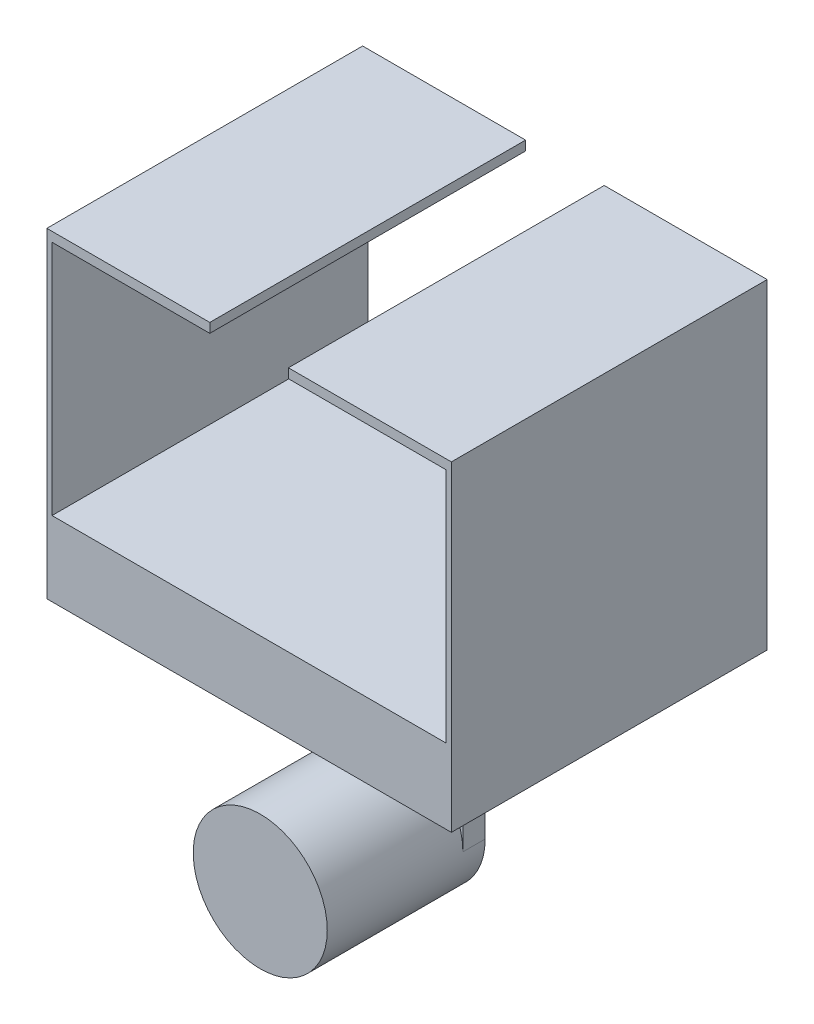
from build123d import *

# Parameters (mm, degrees)
SKETCH1_R           = 10.7823
BOSS_EXTRUDE1_DEPTH = 25.4
SKETCH2_W           = 21.5646
SKETCH2_H           = 25.4
BOSS_EXTRUDE2_DEPTH = 3.5814
SKETCH6_W           = 65.0748
SKETCH6_H           = 50.8
BOSS_EXTRUDE3_DEPTH = 51.6128
SKETCH7_W           = 63.40856
SKETCH7_H           = 38.0746
CUT_EXTRUDE1_DEPTH  = 98.827878248
SKETCH8_W           = 12.6492
SKETCH8_H           = 1.524
CUT_EXTRUDE2_DEPTH  = 98.827878248


with BuildPart() as part:
    # Sketch1 → Boss-Extrude1 (new body)
    with BuildSketch(Plane.XY):
        Circle(SKETCH1_R)
    extrude(amount=-BOSS_EXTRUDE1_DEPTH)

    # Sketch2 → Boss-Extrude2 (add)
    with BuildSketch(Plane(origin=(0, 0, -25.4), x_dir=(-1, 0, 0), z_dir=(0, 0, -1))):
        with Locations((0, 12.7)):
            Rectangle(SKETCH2_W, SKETCH2_H)
    extrude(amount=-BOSS_EXTRUDE2_DEPTH)

    # Sketch6 → Boss-Extrude3 (add)
    with BuildSketch(Plane(origin=(0, 25.4, 0), x_dir=(1, 0, 0), z_dir=(0, 1, 0))):
        with Locations((0, 23.6093)):
            Rectangle(SKETCH6_W, SKETCH6_H)
    extrude(amount=BOSS_EXTRUDE3_DEPTH)

    # Sketch7 → Cut-Extrude1 (cut, through all)
    with BuildSketch(Plane.XY.offset(1.7907)):
        with Locations((0, 56.4515)):
            Rectangle(SKETCH7_W, SKETCH7_H)
    extrude(amount=-CUT_EXTRUDE1_DEPTH, mode=Mode.SUBTRACT)

    # Sketch8 → Cut-Extrude2 (cut, through all)
    with BuildSketch(Plane.XY.offset(1.7907)):
        with Locations((0, 76.2508)):
            Rectangle(SKETCH8_W, SKETCH8_H)
    extrude(amount=-CUT_EXTRUDE2_DEPTH, mode=Mode.SUBTRACT)


solid = part.part
